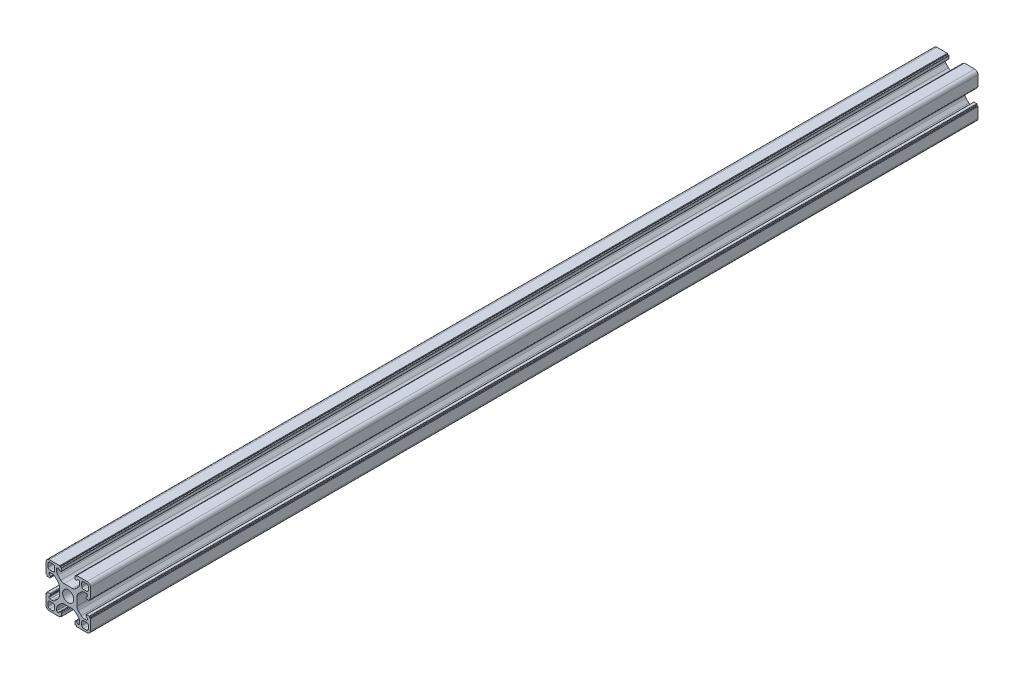
from build123d import *

# Parameters (mm, degrees)
EXTRUDE_1_DEPTH = 400


with BuildPart() as part:
    # Эскиз1 → Бобышка-Вытянуть1 (new body)
    with BuildSketch(Plane.XY):
        with BuildLine():
            Line((-31.105150957, 65.209647948), (-29.206370287, 65.209647948))
            ThreePointArc((-29.206370287, 65.209647948), (-28.441003423, 65.361888883), (-27.792156725, 65.795434385))
            Line((-27.792156725, 65.795434385), (-26.490937394, 67.096653716))
            ThreePointArc((-26.490937394, 67.096653716), (-26.057391892, 67.745500414), (-25.905150957, 68.510867279))
            Line((-25.905150957, 68.510867279), (-25.905150957, 69.409647948))
            ThreePointArc((-25.905150957, 69.409647948), (-26.051597566, 69.763201338), (-26.405150957, 69.909647948))
            Line((-26.405150957, 69.909647948), (-26.508044175, 69.909647948))
            ThreePointArc((-26.508044175, 69.909647948), (-26.699385892, 69.871587714), (-26.861597566, 69.763201338))
            Line((-26.861597566, 69.763201338), (-27.341927652, 69.282871252))
            ThreePointArc((-27.341927652, 69.282871252), (-27.423033489, 69.228678065), (-27.518704347, 69.209647948))
            Line((-27.518704347, 69.209647948), (-27.805150957, 69.209647948))
            ThreePointArc((-27.805150957, 69.209647948), (-27.981927652, 69.282871252), (-28.055150957, 69.459647948))
            Line((-28.055150957, 69.459647948), (-28.055150957, 70.608718768))
            ThreePointArc((-28.055150957, 70.608718768), (-28.011216974, 70.714784785), (-27.905150957, 70.758718768))
            Line((-27.905150957, 70.758718768), (-27.405150957, 70.758718768))
            Line((-27.405150957, 70.758718768), (-27.405150957, 71.059647948))
            ThreePointArc((-27.405150957, 71.059647948), (-27.361216974, 71.165713965), (-27.255150957, 71.209647948))
            Line((-27.255150957, 71.209647948), (-22.605150957, 71.209647948))
            ThreePointArc((-22.605150957, 71.209647948), (-21.544490785, 70.770308119), (-21.105150957, 69.709647948))
            Line((-21.105150957, 69.709647948), (-21.105150957, 65.059647948))
            ThreePointArc((-21.105150957, 65.059647948), (-21.149084939, 64.953581931), (-21.255150957, 64.909647948))
            Line((-21.255150957, 64.909647948), (-21.556080136, 64.909647948))
            Line((-21.556080136, 64.909647948), (-21.556080136, 64.409647948))
            ThreePointArc((-21.556080136, 64.409647948), (-21.600014119, 64.303581931), (-21.706080136, 64.259647948))
            Line((-21.706080136, 64.259647948), (-22.855150957, 64.259647948))
            ThreePointArc((-22.855150957, 64.259647948), (-23.031927652, 64.332871252), (-23.105150957, 64.509647948))
            Line((-23.105150957, 64.509647948), (-23.105150957, 64.796094557))
            ThreePointArc((-23.105150957, 64.796094557), (-23.08612084, 64.891765415), (-23.031927652, 64.972871252))
            Line((-23.031927652, 64.972871252), (-22.551597566, 65.453201338))
            ThreePointArc((-22.551597566, 65.453201338), (-22.44321119, 65.615413013), (-22.405150957, 65.806754729))
            Line((-22.405150957, 65.806754729), (-22.405150957, 65.909647948))
            ThreePointArc((-22.405150957, 65.909647948), (-22.551597566, 66.263201338), (-22.905150957, 66.409647948))
            Line((-22.905150957, 66.409647948), (-23.803931626, 66.409647948))
            ThreePointArc((-23.803931626, 66.409647948), (-24.56929849, 66.257407013), (-25.218145188, 65.82386151))
            Line((-25.218145188, 65.82386151), (-26.519364519, 64.522642179))
            ThreePointArc((-26.519364519, 64.522642179), (-26.952910022, 63.873795482), (-27.105150957, 63.108428617))
            Line((-27.105150957, 63.108428617), (-27.105150957, 61.209647948))
            Line((-27.105150957, 61.209647948), (-27.105150957, 59.310867279))
            ThreePointArc((-27.105150957, 59.310867279), (-26.952910022, 58.545500414), (-26.519364519, 57.896653716))
            Line((-26.519364519, 57.896653716), (-25.218145188, 56.595434385))
            ThreePointArc((-25.218145188, 56.595434385), (-24.56929849, 56.161888883), (-23.803931626, 56.009647948))
            Line((-23.803931626, 56.009647948), (-22.905150957, 56.009647948))
            ThreePointArc((-22.905150957, 56.009647948), (-22.551597566, 56.156094557), (-22.405150957, 56.509647948))
            Line((-22.405150957, 56.509647948), (-22.405150957, 56.612541166))
            ThreePointArc((-22.405150957, 56.612541166), (-22.44321119, 56.803882883), (-22.551597566, 56.966094557))
            Line((-22.551597566, 56.966094557), (-23.031927652, 57.446424643))
            ThreePointArc((-23.031927652, 57.446424643), (-23.08612084, 57.52753048), (-23.105150957, 57.623201338))
            Line((-23.105150957, 57.623201338), (-23.105150957, 57.909647948))
            ThreePointArc((-23.105150957, 57.909647948), (-23.031927652, 58.086424643), (-22.855150957, 58.159647948))
            Line((-22.855150957, 58.159647948), (-21.706080136, 58.159647948))
            ThreePointArc((-21.706080136, 58.159647948), (-21.600014119, 58.115713965), (-21.556080136, 58.009647948))
            Line((-21.556080136, 58.009647948), (-21.556080136, 57.509647948))
            Line((-21.556080136, 57.509647948), (-21.255150957, 57.509647948))
            ThreePointArc((-21.255150957, 57.509647948), (-21.149084939, 57.465713965), (-21.105150957, 57.359647948))
            Line((-21.105150957, 57.359647948), (-21.105150957, 52.709647948))
            ThreePointArc((-21.105150957, 52.709647948), (-21.544490785, 51.648987776), (-22.605150957, 51.209647948))
            Line((-22.605150957, 51.209647948), (-27.255150957, 51.209647948))
            ThreePointArc((-27.255150957, 51.209647948), (-27.361216974, 51.253581931), (-27.405150957, 51.359647948))
            Line((-27.405150957, 51.359647948), (-27.405150957, 51.660577127))
            Line((-27.405150957, 51.660577127), (-27.905150957, 51.660577127))
            ThreePointArc((-27.905150957, 51.660577127), (-28.011216974, 51.70451111), (-28.055150957, 51.810577127))
            Line((-28.055150957, 51.810577127), (-28.055150957, 52.959647948))
            ThreePointArc((-28.055150957, 52.959647948), (-27.981927652, 53.136424643), (-27.805150957, 53.209647948))
            Line((-27.805150957, 53.209647948), (-27.518704347, 53.209647948))
            ThreePointArc((-27.518704347, 53.209647948), (-27.423033489, 53.190617831), (-27.341927652, 53.136424643))
            Line((-27.341927652, 53.136424643), (-26.861597566, 52.656094557))
            ThreePointArc((-26.861597566, 52.656094557), (-26.699385892, 52.547708181), (-26.508044175, 52.509647948))
            Line((-26.508044175, 52.509647948), (-26.405150957, 52.509647948))
            ThreePointArc((-26.405150957, 52.509647948), (-26.051597566, 52.656094557), (-25.905150957, 53.009647948))
            Line((-25.905150957, 53.009647948), (-25.905150957, 53.908428617))
            ThreePointArc((-25.905150957, 53.908428617), (-26.057391892, 54.673795482), (-26.490937394, 55.322642179))
            Line((-26.490937394, 55.322642179), (-27.792156725, 56.62386151))
            ThreePointArc((-27.792156725, 56.62386151), (-28.441003423, 57.057407013), (-29.206370287, 57.209647948))
            Line((-29.206370287, 57.209647948), (-31.105150957, 57.209647948))
            Line((-31.105150957, 57.209647948), (-33.003931626, 57.209647948))
            ThreePointArc((-33.003931626, 57.209647948), (-33.76929849, 57.057407013), (-34.418145188, 56.62386151))
            Line((-34.418145188, 56.62386151), (-35.719364519, 55.322642179))
            ThreePointArc((-35.719364519, 55.322642179), (-36.152910022, 54.673795482), (-36.305150957, 53.908428617))
            Line((-36.305150957, 53.908428617), (-36.305150957, 53.009647948))
            ThreePointArc((-36.305150957, 53.009647948), (-36.158704347, 52.656094557), (-35.805150957, 52.509647948))
            Line((-35.805150957, 52.509647948), (-35.702257738, 52.509647948))
            ThreePointArc((-35.702257738, 52.509647948), (-35.510916022, 52.547708181), (-35.348704347, 52.656094557))
            Line((-35.348704347, 52.656094557), (-34.868374261, 53.136424643))
            ThreePointArc((-34.868374261, 53.136424643), (-34.787268424, 53.190617831), (-34.691597566, 53.209647948))
            Line((-34.691597566, 53.209647948), (-34.405150957, 53.209647948))
            ThreePointArc((-34.405150957, 53.209647948), (-34.228374261, 53.136424643), (-34.155150957, 52.959647948))
            Line((-34.155150957, 52.959647948), (-34.155150957, 51.810577127))
            ThreePointArc((-34.155150957, 51.810577127), (-34.199084939, 51.70451111), (-34.305150957, 51.660577127))
            Line((-34.305150957, 51.660577127), (-34.805150957, 51.660577127))
            Line((-34.805150957, 51.660577127), (-34.805150957, 51.359647948))
            ThreePointArc((-34.805150957, 51.359647948), (-34.849084939, 51.253581931), (-34.955150957, 51.209647948))
            Line((-34.955150957, 51.209647948), (-39.605150957, 51.209647948))
            ThreePointArc((-39.605150957, 51.209647948), (-40.665811128, 51.648987776), (-41.105150957, 52.709647948))
            Line((-41.105150957, 52.709647948), (-41.105150957, 57.359647948))
            ThreePointArc((-41.105150957, 57.359647948), (-41.061216974, 57.465713965), (-40.955150957, 57.509647948))
            Line((-40.955150957, 57.509647948), (-40.654221777, 57.509647948))
            Line((-40.654221777, 57.509647948), (-40.654221777, 58.009647948))
            ThreePointArc((-40.654221777, 58.009647948), (-40.610287794, 58.115713965), (-40.504221777, 58.159647948))
            Line((-40.504221777, 58.159647948), (-39.355150957, 58.159647948))
            ThreePointArc((-39.355150957, 58.159647948), (-39.178374261, 58.086424643), (-39.105150957, 57.909647948))
            Line((-39.105150957, 57.909647948), (-39.105150957, 57.623201338))
            ThreePointArc((-39.105150957, 57.623201338), (-39.124181073, 57.52753048), (-39.178374261, 57.446424643))
            Line((-39.178374261, 57.446424643), (-39.658704347, 56.966094557))
            ThreePointArc((-39.658704347, 56.966094557), (-39.767090723, 56.803882883), (-39.805150957, 56.612541166))
            Line((-39.805150957, 56.612541166), (-39.805150957, 56.509647948))
            ThreePointArc((-39.805150957, 56.509647948), (-39.658704347, 56.156094557), (-39.305150957, 56.009647948))
            Line((-39.305150957, 56.009647948), (-38.406370287, 56.009647948))
            ThreePointArc((-38.406370287, 56.009647948), (-37.641003423, 56.161888883), (-36.992156725, 56.595434385))
            Line((-36.992156725, 56.595434385), (-35.690937394, 57.896653716))
            ThreePointArc((-35.690937394, 57.896653716), (-35.257391892, 58.545500414), (-35.105150957, 59.310867279))
            Line((-35.105150957, 59.310867279), (-35.105150957, 61.209647948))
            Line((-35.105150957, 61.209647948), (-35.105150957, 63.108428617))
            ThreePointArc((-35.105150957, 63.108428617), (-35.257391892, 63.873795482), (-35.690937394, 64.522642179))
            Line((-35.690937394, 64.522642179), (-36.992156725, 65.82386151))
            ThreePointArc((-36.992156725, 65.82386151), (-37.641003423, 66.257407013), (-38.406370287, 66.409647948))
            Line((-38.406370287, 66.409647948), (-39.305150957, 66.409647948))
            ThreePointArc((-39.305150957, 66.409647948), (-39.658704347, 66.263201338), (-39.805150957, 65.909647948))
            Line((-39.805150957, 65.909647948), (-39.805150957, 65.806754729))
            ThreePointArc((-39.805150957, 65.806754729), (-39.767090723, 65.615413013), (-39.658704347, 65.453201338))
            Line((-39.658704347, 65.453201338), (-39.178374261, 64.972871252))
            ThreePointArc((-39.178374261, 64.972871252), (-39.124181073, 64.891765415), (-39.105150957, 64.796094557))
            Line((-39.105150957, 64.796094557), (-39.105150957, 64.509647948))
            ThreePointArc((-39.105150957, 64.509647948), (-39.178374261, 64.332871252), (-39.355150957, 64.259647948))
            Line((-39.355150957, 64.259647948), (-40.504221777, 64.259647948))
            ThreePointArc((-40.504221777, 64.259647948), (-40.610287794, 64.303581931), (-40.654221777, 64.409647948))
            Line((-40.654221777, 64.409647948), (-40.654221777, 64.909647948))
            Line((-40.654221777, 64.909647948), (-40.955150957, 64.909647948))
            ThreePointArc((-40.955150957, 64.909647948), (-41.061216974, 64.953581931), (-41.105150957, 65.059647948))
            Line((-41.105150957, 65.059647948), (-41.105150957, 69.709647948))
            ThreePointArc((-41.105150957, 69.709647948), (-40.665811128, 70.770308119), (-39.605150957, 71.209647948))
            Line((-39.605150957, 71.209647948), (-34.955150957, 71.209647948))
            ThreePointArc((-34.955150957, 71.209647948), (-34.849084939, 71.165713965), (-34.805150957, 71.059647948))
            Line((-34.805150957, 71.059647948), (-34.805150957, 70.758718768))
            Line((-34.805150957, 70.758718768), (-34.305150957, 70.758718768))
            ThreePointArc((-34.305150957, 70.758718768), (-34.199084939, 70.714784785), (-34.155150957, 70.608718768))
            Line((-34.155150957, 70.608718768), (-34.155150957, 69.459647948))
            ThreePointArc((-34.155150957, 69.459647948), (-34.228374261, 69.282871252), (-34.405150957, 69.209647948))
            Line((-34.405150957, 69.209647948), (-34.691597566, 69.209647948))
            ThreePointArc((-34.691597566, 69.209647948), (-34.787268424, 69.228678065), (-34.868374261, 69.282871252))
            Line((-34.868374261, 69.282871252), (-35.348704347, 69.763201338))
            ThreePointArc((-35.348704347, 69.763201338), (-35.510916022, 69.871587714), (-35.702257738, 69.909647948))
            Line((-35.702257738, 69.909647948), (-35.805150957, 69.909647948))
            ThreePointArc((-35.805150957, 69.909647948), (-36.158704347, 69.763201338), (-36.305150957, 69.409647948))
            Line((-36.305150957, 69.409647948), (-36.305150957, 68.510867279))
            ThreePointArc((-36.305150957, 68.510867279), (-36.152910022, 67.745500414), (-35.719364519, 67.096653716))
            Line((-35.719364519, 67.096653716), (-34.418145188, 65.795434385))
            ThreePointArc((-34.418145188, 65.795434385), (-33.76929849, 65.361888883), (-33.003931626, 65.209647948))
            Line((-33.003931626, 65.209647948), (-31.105150957, 65.209647948))
        make_face()
        with BuildLine():
            Line((-24.205150957, 67.309647948), (-22.805150957, 67.309647948))
            ThreePointArc((-22.805150957, 67.309647948), (-22.239465532, 67.543962523), (-22.005150957, 68.109647948))
            Line((-22.005150957, 68.109647948), (-22.005150957, 69.509647948))
            ThreePointArc((-22.005150957, 69.509647948), (-22.239465532, 70.075333373), (-22.805150957, 70.309647948))
            Line((-22.805150957, 70.309647948), (-24.205150957, 70.309647948))
            ThreePointArc((-24.205150957, 70.309647948), (-24.770836381, 70.075333373), (-25.005150957, 69.509647948))
            Line((-25.005150957, 69.509647948), (-25.005150957, 68.109647948))
            ThreePointArc((-25.005150957, 68.109647948), (-24.770836381, 67.543962523), (-24.205150957, 67.309647948))
        make_face(mode=Mode.SUBTRACT)
        with BuildLine():
            Line((-25.005150957, 54.309647948), (-25.005150957, 52.909647948))
            ThreePointArc((-25.005150957, 52.909647948), (-24.770836381, 52.343962523), (-24.205150957, 52.109647948))
            Line((-24.205150957, 52.109647948), (-22.805150957, 52.109647948))
            ThreePointArc((-22.805150957, 52.109647948), (-22.239465532, 52.343962523), (-22.005150957, 52.909647948))
            Line((-22.005150957, 52.909647948), (-22.005150957, 54.309647948))
            ThreePointArc((-22.005150957, 54.309647948), (-22.239465532, 54.875333373), (-22.805150957, 55.109647948))
            Line((-22.805150957, 55.109647948), (-24.205150957, 55.109647948))
            ThreePointArc((-24.205150957, 55.109647948), (-24.770836381, 54.875333373), (-25.005150957, 54.309647948))
        make_face(mode=Mode.SUBTRACT)
        with BuildLine():
            Line((-38.005150957, 55.109647948), (-39.405150957, 55.109647948))
            ThreePointArc((-39.405150957, 55.109647948), (-39.970836381, 54.875333373), (-40.205150957, 54.309647948))
            Line((-40.205150957, 54.309647948), (-40.205150957, 52.909647948))
            ThreePointArc((-40.205150957, 52.909647948), (-39.970836381, 52.343962523), (-39.405150957, 52.109647948))
            Line((-39.405150957, 52.109647948), (-38.005150957, 52.109647948))
            ThreePointArc((-38.005150957, 52.109647948), (-37.439465532, 52.343962523), (-37.205150957, 52.909647948))
            Line((-37.205150957, 52.909647948), (-37.205150957, 54.309647948))
            ThreePointArc((-37.205150957, 54.309647948), (-37.439465532, 54.875333373), (-38.005150957, 55.109647948))
        make_face(mode=Mode.SUBTRACT)
        with BuildLine():
            Line((-37.205150957, 68.109647948), (-37.205150957, 69.509647948))
            ThreePointArc((-37.205150957, 69.509647948), (-37.439465532, 70.075333373), (-38.005150957, 70.309647948))
            Line((-38.005150957, 70.309647948), (-39.405150957, 70.309647948))
            ThreePointArc((-39.405150957, 70.309647948), (-39.970836381, 70.075333373), (-40.205150957, 69.509647948))
            Line((-40.205150957, 69.509647948), (-40.205150957, 68.109647948))
            ThreePointArc((-40.205150957, 68.109647948), (-39.970836381, 67.543962523), (-39.405150957, 67.309647948))
            Line((-39.405150957, 67.309647948), (-38.005150957, 67.309647948))
            ThreePointArc((-38.005150957, 67.309647948), (-37.439465532, 67.543962523), (-37.205150957, 68.109647948))
        make_face(mode=Mode.SUBTRACT)
        with BuildLine():
            ThreePointArc((-28.605150957, 61.209647948), (-29.337384004, 62.977414901), (-31.105150957, 63.709647948))
            ThreePointArc((-31.105150957, 63.709647948), (-32.87291791, 62.977414901), (-33.605150957, 61.209647948))
            ThreePointArc((-33.605150957, 61.209647948), (-32.87291791, 59.441880995), (-31.105150957, 58.709647948))
            ThreePointArc((-31.105150957, 58.709647948), (-29.337384004, 59.441880995), (-28.605150957, 61.209647948))
        make_face(mode=Mode.SUBTRACT)
    extrude(amount=EXTRUDE_1_DEPTH)


solid = part.part
